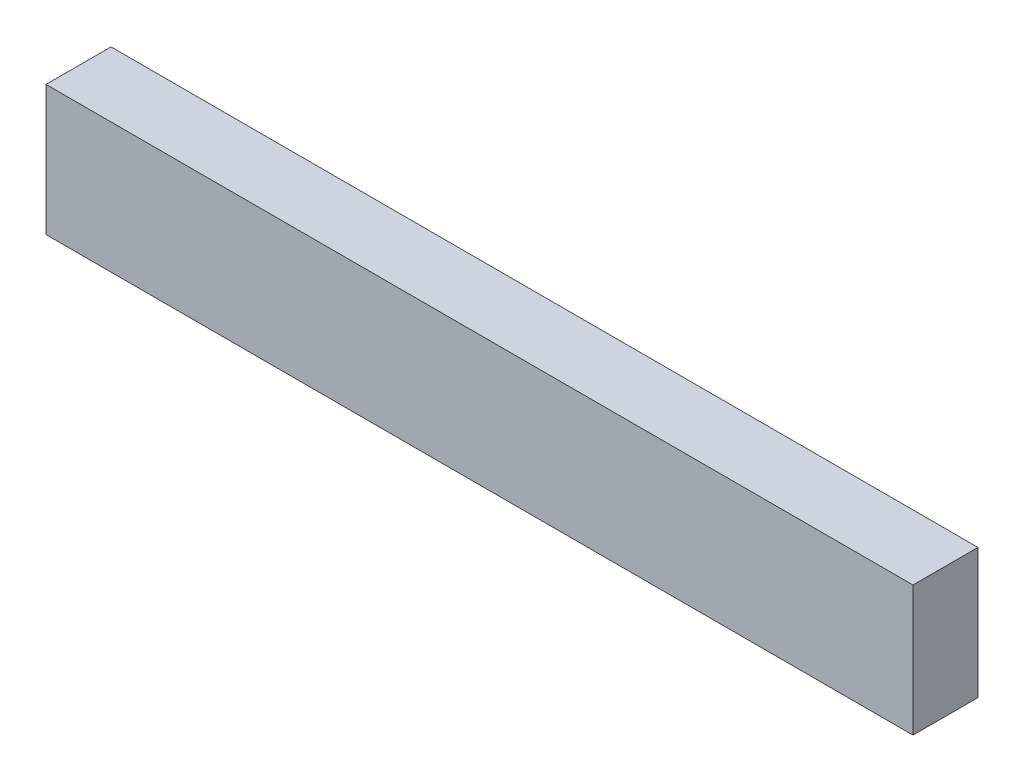
from build123d import *

# Parameters (mm, degrees)
SKETCH_1_W      = 80
SKETCH_1_H      = 6
EXTRUDE_1_DEPTH = 12


with BuildPart() as part:
    # 草图1 → 凸台-拉伸1 (new body)
    with BuildSketch(Plane(origin=(0, 0, 0), x_dir=(1, 0, 0), z_dir=(0, 1, 0))):
        Rectangle(SKETCH_1_W, SKETCH_1_H)
    extrude(amount=EXTRUDE_1_DEPTH)


solid = part.part
